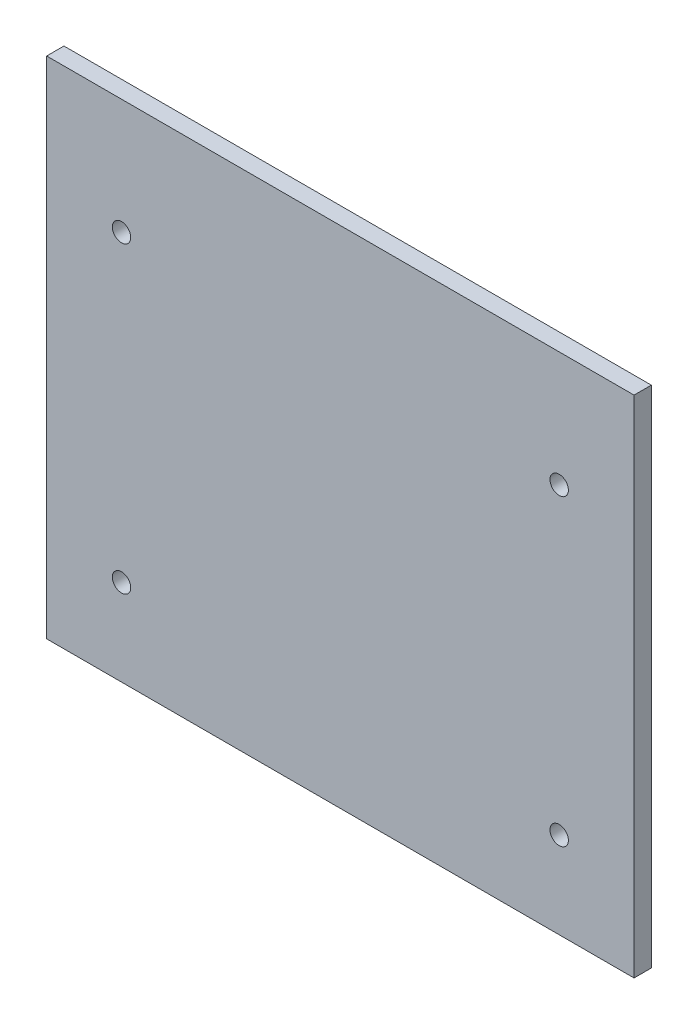
from build123d import *

# Parameters (mm, degrees)
SKETCH_1_W      = 102
SKETCH_1_H      = 87.661967101
SKETCH_1_R      = 1.6
EXTRUDE_1_DEPTH = 3


with BuildPart() as part:
    # 草图1 → 凸台-拉伸1 (new body)
    with BuildSketch(Plane.XY):
        with Locations((0, -52.391729519)):
            Rectangle(SKETCH_1_W, SKETCH_1_H)
        with Locations((-38, -81.222713069)):
            Circle(SKETCH_1_R, mode=Mode.SUBTRACT)
        with Locations((38, -81.222713069)):
            Circle(SKETCH_1_R, mode=Mode.SUBTRACT)
        with Locations((38, -28.560745968)):
            Circle(SKETCH_1_R, mode=Mode.SUBTRACT)
        with Locations((-38, -28.560745968)):
            Circle(SKETCH_1_R, mode=Mode.SUBTRACT)
    extrude(amount=EXTRUDE_1_DEPTH)


solid = part.part
